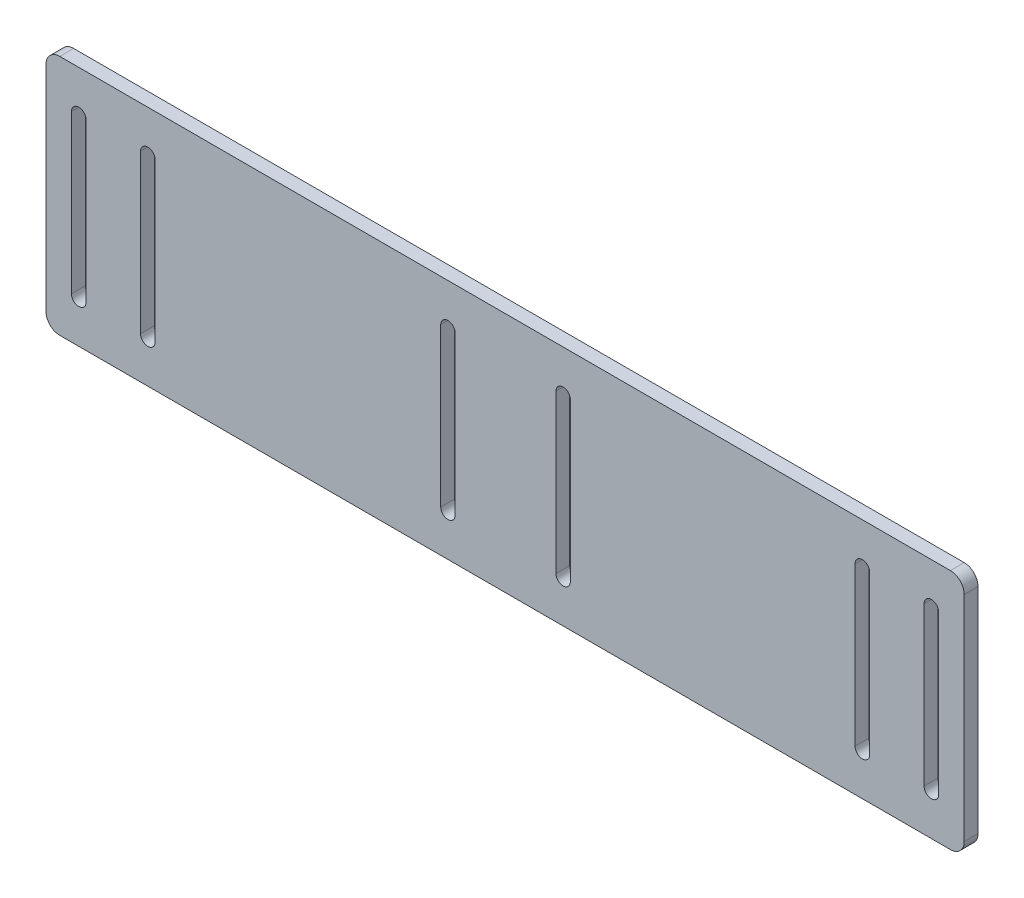
from build123d import *

# Parameters (mm, degrees)
BOSS_EXTRUDE3_DEPTH = 8
FILLET1_R           = 8
CUT_EXTRUDE3_DEPTH  = 10


with BuildPart() as part:
    # Sketch2 → Boss-Extrude3 (new body)
    with BuildSketch(Plane.XY.offset(-1024.085734242)):
        Polygon((-493.118842126, 700), (-493.118842126, 560), (-480.118842126, 560), (38.881157874, 560), (38.881157874, 700), (-480.118842126, 700), align=None)
        with BuildLine():
            Line((15.631157874, 584.25), (15.631157874, 675.75))
            ThreePointArc((15.631157874, 675.75), (19.881157874, 680), (24.131157874, 675.75))
            Line((24.131157874, 675.75), (24.131157874, 584.25))
            ThreePointArc((24.131157874, 584.25), (19.881157874, 580), (15.631157874, 584.25))
        make_face(mode=Mode.SUBTRACT)
        with BuildLine():
            Line((-15.868842127, 584.25), (-15.868842127, 675.75))
            ThreePointArc((-15.868842127, 675.75), (-20.118842127, 680), (-24.368842127, 675.75))
            Line((-24.368842127, 675.75), (-24.368842127, 584.25))
            ThreePointArc((-24.368842127, 584.25), (-20.118842127, 580), (-15.868842127, 584.25))
        make_face(mode=Mode.SUBTRACT)
        with BuildLine():
            Line((-438.368842126, 584.25), (-438.368842126, 675.75))
            ThreePointArc((-438.368842126, 675.75), (-434.118842126, 680), (-429.868842126, 675.75))
            Line((-429.868842126, 675.75), (-429.868842126, 584.25))
            ThreePointArc((-429.868842126, 584.25), (-434.118842126, 580), (-438.368842126, 584.25))
        make_face(mode=Mode.SUBTRACT)
        with BuildLine():
            Line((-469.868842126, 584.25), (-469.868842126, 675.75))
            ThreePointArc((-469.868842126, 675.75), (-474.118842126, 680), (-478.368842126, 675.75))
            Line((-478.368842126, 675.75), (-478.368842126, 584.25))
            ThreePointArc((-478.368842126, 584.25), (-474.118842126, 580), (-469.868842126, 584.25))
        make_face(mode=Mode.SUBTRACT)
    extrude(amount=BOSS_EXTRUDE3_DEPTH)

    # Fillet1
    fillet1_edges = [part.edges().sort_by_distance(p)[0] for p in [
        (-493.118842126, 560, -1020.085734242),
        (-493.118842126, 700, -1020.085734242),
        (38.881157874, 700, -1020.085734242),
        (38.881157874, 560, -1020.085734242),
    ]]
    fillet(fillet1_edges, radius=FILLET1_R)

    # Sketch7 → Cut-Extrude3 (cut)
    with BuildSketch(Plane.XY.offset(-1016.085734242)):
        with BuildLine():
            Line((-256.068842126, 675.75), (-256.068842126, 584.25))
            ThreePointArc((-256.068842126, 584.25), (-260.243842126, 580.075), (-264.418842126, 584.25))
            Line((-264.418842126, 584.25), (-264.418842126, 675.75))
            ThreePointArc((-264.418842126, 675.75), (-260.243842126, 679.925), (-256.068842126, 675.75))
        make_face()
        with BuildLine():
            Line((-197.668842126, 675.75), (-197.668842126, 584.25))
            ThreePointArc((-197.668842126, 584.25), (-193.493842126, 580.075), (-189.318842126, 584.25))
            Line((-189.318842126, 584.25), (-189.318842126, 675.75))
            ThreePointArc((-189.318842126, 675.75), (-193.493842126, 679.925), (-197.668842126, 675.75))
        make_face()
    extrude(amount=-CUT_EXTRUDE3_DEPTH, mode=Mode.SUBTRACT)


solid = part.part
